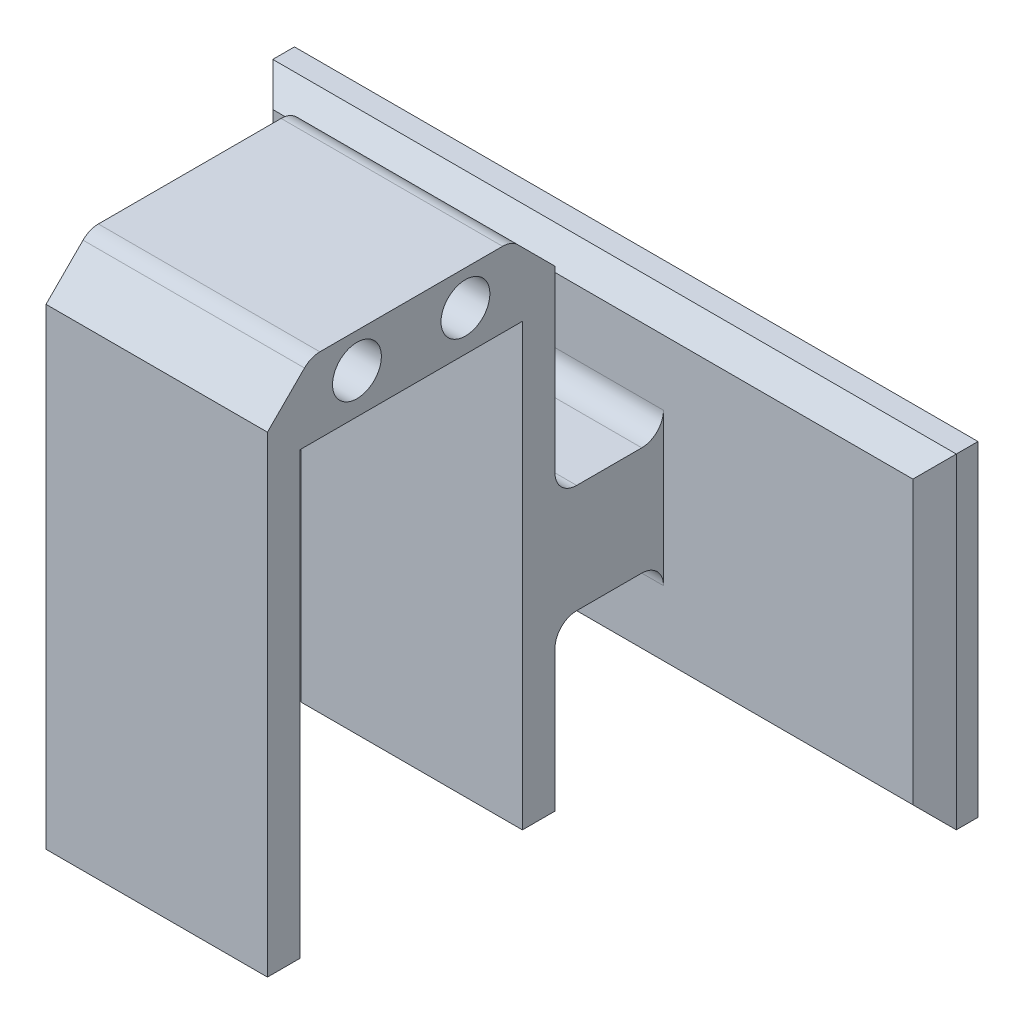
from build123d import *

# Parameters (mm, degrees)
SKETCH1_R           = 2.25
BOSS_EXTRUDE1_DEPTH = 20
SKETCH2_R           = 2.25
BOSS_EXTRUDE2_DEPTH = 10
SKETCH4_W           = 26.5
SKETCH4_H           = 2.5
CUT_EXTRUDE1_DEPTH  = 39.17921555
CHAMFER2_SIZE       = 4
CHAMFER3_SIZE       = 4
FILLET4_R           = 2
SKETCH7_W           = 10
SKETCH7_H           = 10
BOSS_EXTRUDE5_DEPTH = 20
FILLET6_R           = 2
SKETCH8_W           = 63
SKETCH8_H           = 30
BOSS_EXTRUDE6_DEPTH = 4
CHAMFER4_SIZE       = 2
FILLET7_R           = 2
SKETCH13_R          = 2.25
BOSS_EXTRUDE7_DEPTH = 0.41


with BuildPart() as part:
    # Sketch1 → Boss-Extrude1 (new body)
    with BuildSketch(Plane(origin=(0, 0, 0), x_dir=(0, 0, -1), z_dir=(1, 0, 0))):
        Polygon((10.25, -20.3), (13.25, -20.3), (13.25, 29.7), (-13.25, 29.7), (-13.25, -20.3), (-10.25, -20.3), (-10.25, 20.3), (10.25, 20.3), align=None)
        with Locations((5, 24)):
            Circle(SKETCH1_R, mode=Mode.SUBTRACT)
        with Locations((-5, 24)):
            Circle(SKETCH1_R, mode=Mode.SUBTRACT)
    extrude(amount=BOSS_EXTRUDE1_DEPTH)

    # Sketch2 → Boss-Extrude2 (add)
    with BuildSketch(Plane.ZY):
        with Locations((-5, 24)):
            Circle(SKETCH2_R)
        with Locations((5, 24)):
            Circle(SKETCH2_R)
    extrude(amount=-BOSS_EXTRUDE2_DEPTH)

    # Sketch4 → Cut-Extrude1 (cut, through all)
    with BuildSketch(Plane(origin=(20, 0, 0), x_dir=(0, 0, -1), z_dir=(1, 0, 0))):
        with Locations((0, 28.45)):
            Rectangle(SKETCH4_W, SKETCH4_H)
    extrude(amount=-CUT_EXTRUDE1_DEPTH, mode=Mode.SUBTRACT)

    # Chamfer2
    chamfer2_edges = [part.edges().sort_by_distance(p)[0] for p in [
        (10, 27.2, -13.25),
    ]]
    chamfer(chamfer2_edges, length=CHAMFER2_SIZE)

    # Chamfer3
    chamfer3_edges = [part.edges().sort_by_distance(p)[0] for p in [
        (10, 27.2, 13.25),
    ]]
    chamfer(chamfer3_edges, length=CHAMFER3_SIZE)

    # Fillet4
    fillet4_edges = [part.edges().sort_by_distance(p)[0] for p in [
        (10, 27.2, -9.25),
        (10, 27.2, 9.25),
    ]]
    fillet(fillet4_edges, radius=FILLET4_R)

    # Sketch7 → Boss-Extrude5 (add)
    with BuildSketch(Plane(origin=(20, 0, 0), x_dir=(0, 0, -1), z_dir=(1, 0, 0))):
        with Locations((18.25, -0.3)):
            Rectangle(SKETCH7_W, SKETCH7_H)
    extrude(amount=-BOSS_EXTRUDE5_DEPTH)

    # Fillet6
    fillet6_edges = [part.edges().sort_by_distance(p)[0] for p in [
        (10, -5.3, -13.25),
        (10, 4.7, -13.25),
    ]]
    fillet(fillet6_edges, radius=FILLET6_R)

    # Sketch8 → Boss-Extrude6 (add)
    with BuildSketch(Plane(origin=(0, 0, -23.25), x_dir=(-1, 0, 0), z_dir=(0, 0, -1))):
        with Locations((-13.9, -0.3)):
            Rectangle(SKETCH8_W, SKETCH8_H)
    extrude(amount=BOSS_EXTRUDE6_DEPTH)

    # Chamfer4
    chamfer4_edges = [part.edges().sort_by_distance(p)[0] for p in [
        (45.4, -0.3, -23.25),
        (13.9, -15.3, -23.25),
        (-17.6, -0.3, -23.25),
        (13.9, 14.7, -23.25),
    ]]
    chamfer(chamfer4_edges, length=CHAMFER4_SIZE)

    # Fillet7
    fillet7_edges = [part.edges().sort_by_distance(p)[0] for p in [
        (10, 4.7, -23.25),
        (10, -5.3, -23.25),
    ]]
    fillet(fillet7_edges, radius=FILLET7_R)

    # Sketch13 → Boss-Extrude7 (add)
    with BuildSketch(Plane(origin=(20, 0, 0), x_dir=(0, 0, -1), z_dir=(1, 0, 0))):
        with BuildLine():
            Line((13.25, 23.2), (9.835786438, 26.614213562))
            ThreePointArc((9.835786438, 26.614213562), (9.18693974, 27.047759065), (8.421572875, 27.2))
            Line((8.421572875, 27.2), (-8.421572875, 27.2))
            ThreePointArc((-8.421572875, 27.2), (-9.18693974, 27.047759065), (-9.835786438, 26.614213562))
            Line((-9.835786438, 26.614213562), (-13.25, 23.2))
            Line((-13.25, 23.2), (-13.25, -20.3))
            Line((-13.25, -20.3), (-10.25, -20.3))
            Line((-10.25, -20.3), (-10.25, 20.3))
            Line((-10.25, 20.3), (10.25, 20.3))
            Line((10.25, 20.3), (10.25, -20.3))
            Line((10.25, -20.3), (13.25, -20.3))
            Line((13.25, -20.3), (13.25, -7.3))
            ThreePointArc((13.25, -7.3), (13.835786438, -5.885786438), (15.25, -5.3))
            Line((15.25, -5.3), (21.25, -5.3))
            ThreePointArc((21.25, -5.3), (22.664213562, -5.885786438), (23.25, -7.3))
            Line((23.25, -7.3), (23.25, 6.7))
            ThreePointArc((23.25, 6.7), (22.664213562, 5.285786438), (21.25, 4.7))
            Line((21.25, 4.7), (15.25, 4.7))
            ThreePointArc((15.25, 4.7), (13.835786438, 5.285786438), (13.25, 6.7))
            Line((13.25, 6.7), (13.25, 23.2))
        make_face()
        with Locations(Location((5, 24, 0), (0, 0, 180))):
            Circle(SKETCH13_R, mode=Mode.SUBTRACT)
        with Locations(Location((-5, 24, 0), (0, 0, 180))):
            Circle(SKETCH13_R, mode=Mode.SUBTRACT)
    extrude(amount=BOSS_EXTRUDE7_DEPTH)


solid = part.part
